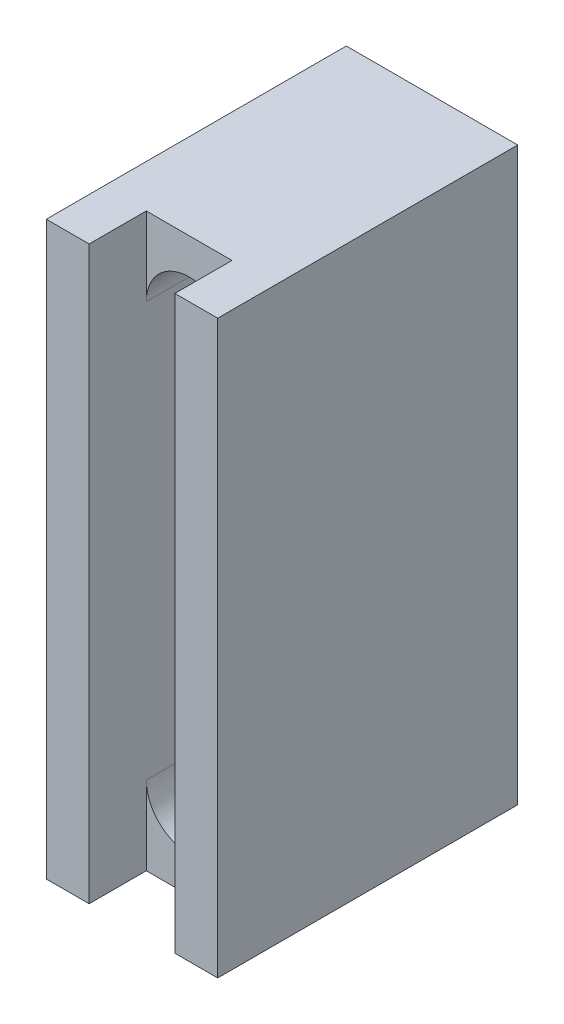
from build123d import *

# Parameters (mm, degrees)
ESQUISSE1_W      = 12
ESQUISSE1_H      = 40
EXTRUSION1_DEPTH = 17
EXTRUSION2_DEPTH = 12
ESQUISSE3_W      = 6
ESQUISSE3_H      = 3
EXTRUSION3_DEPTH = 25.083189158
ESQUISSE4_W      = 3
ESQUISSE4_H      = 40
EXTRUSION4_DEPTH = 4


with BuildPart() as part:
    # Esquisse1 → Extrusion1 (new body)
    with BuildSketch(Plane.XY):
        Rectangle(ESQUISSE1_W, ESQUISSE1_H)
    extrude(amount=EXTRUSION1_DEPTH)

    # Esquisse2 → Extrusion2 (cut)
    with BuildSketch(Plane.XY.offset(17)):
        with BuildLine():
            Line((-3, 14.5), (-3, -14.5))
            ThreePointArc((-3, -14.5), (0, -17.5), (3, -14.5))
            Line((3, -14.5), (3, 14.5))
            ThreePointArc((3, 14.5), (0, 17.5), (-3, 14.5))
        make_face()
    extrude(amount=-EXTRUSION2_DEPTH, mode=Mode.SUBTRACT)

    # Esquisse3 → Extrusion3 (cut, through all)
    with BuildSketch(Plane.XY.offset(5)):
        Rectangle(ESQUISSE3_W, ESQUISSE3_H)
    extrude(amount=-EXTRUSION3_DEPTH, mode=Mode.SUBTRACT)

    # Esquisse4 → Extrusion4 (add)
    with BuildSketch(Plane.XY.offset(17)):
        with Locations((4.5, 0)):
            Rectangle(ESQUISSE4_W, ESQUISSE4_H)
        with Locations((-4.5, 0)):
            Rectangle(ESQUISSE4_W, ESQUISSE4_H)
    extrude(amount=EXTRUSION4_DEPTH)


solid = part.part
